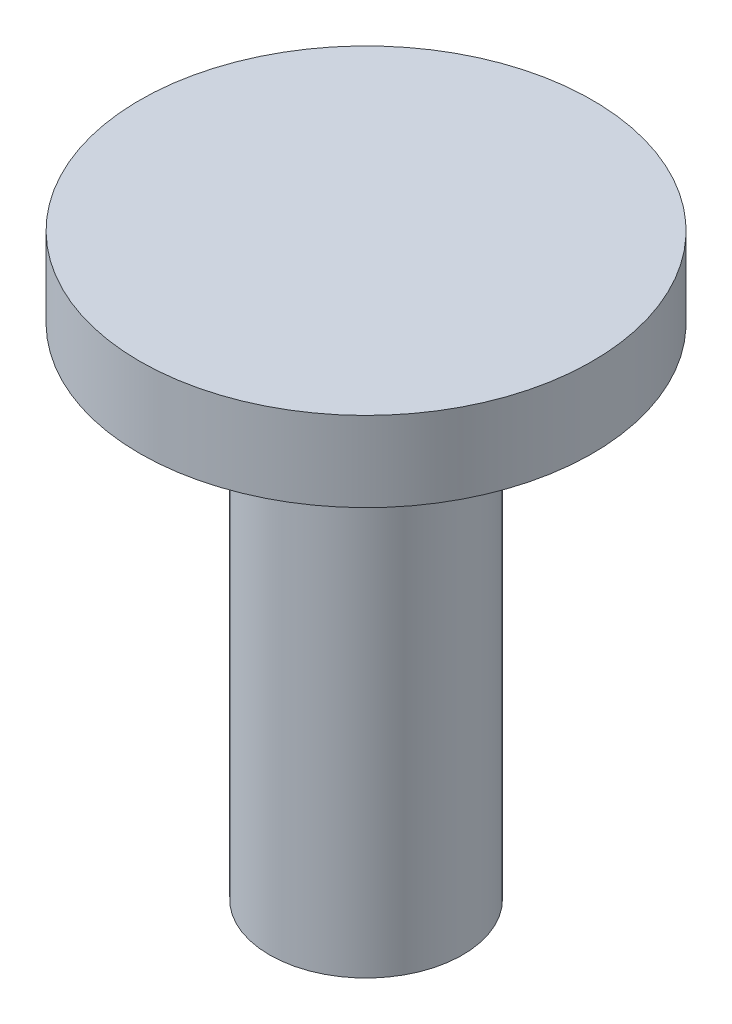
from build123d import *

# Parameters (mm, degrees)
SKETCH1_R           = 1.45
BOSS_EXTRUDE1_DEPTH = 7.5
SKETCH2_R           = 3.4
BOSS_EXTRUDE2_DEPTH = 1.2


with BuildPart() as part:
    # Sketch1 → Boss-Extrude1 (new body)
    with BuildSketch(Plane(origin=(0, 0, 0), x_dir=(1, 0, 0), z_dir=(0, 1, 0))):
        with Locations(Location((0, 0, 0), (0, 0, 270))):
            Circle(SKETCH1_R)
    extrude(amount=BOSS_EXTRUDE1_DEPTH)

    # Sketch2 → Boss-Extrude2 (add)
    with BuildSketch(Plane(origin=(0, 7.5, 0), x_dir=(1, 0, 0), z_dir=(0, 1, 0))):
        with Locations(Location((0, 0, 0), (0, 0, 270))):
            Circle(SKETCH2_R)
    extrude(amount=BOSS_EXTRUDE2_DEPTH)


solid = part.part
